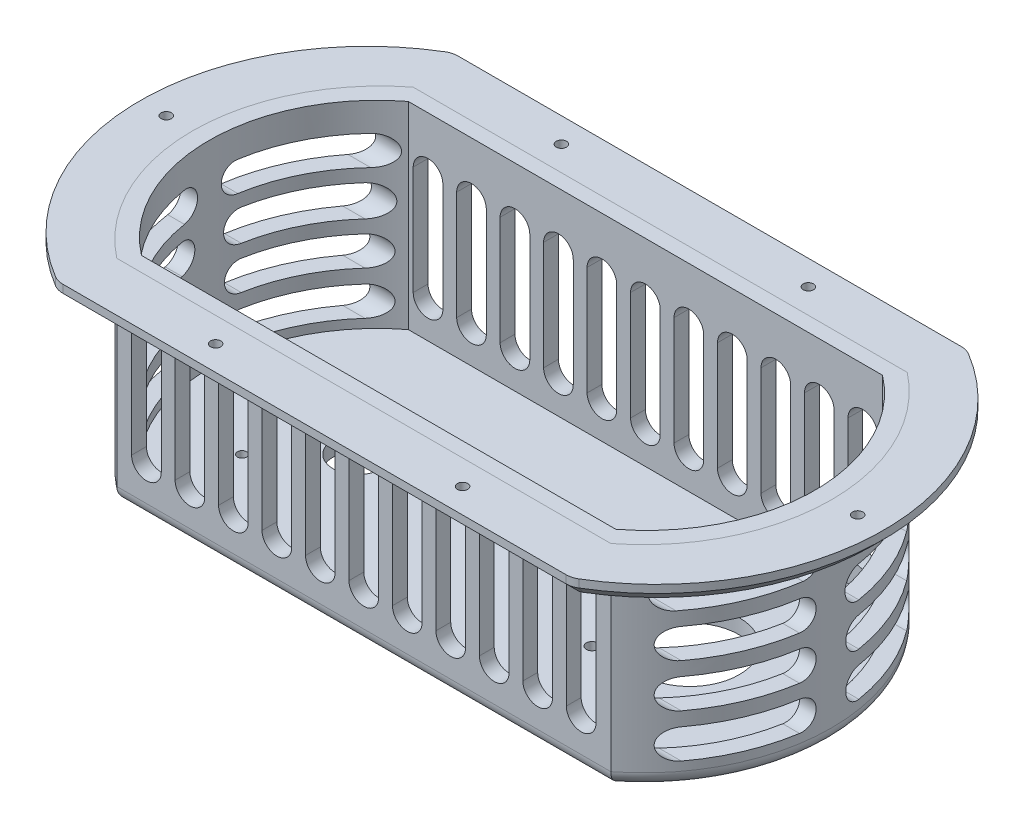
from build123d import *

# Parameters (mm, degrees)
BOSS_EXTRUDE1_DEPTH      = 10
BOSS_EXTRUDE2_DEPTH      = 100
CUT_EXTRUDE1_DEPTH       = 85
FILLET2_R                = 10
SKETCH10_R               = 4.6
CUT_EXTRUDE2_DEPTH       = 5
SKETCH10_3_R             = 4.6
CUT_EXTRUDE3_DEPTH       = 5
SKETCH10_4_R             = 4.6
CUT_EXTRUDE4_DEPTH       = 5
SKETCH10_5_R             = 4.6
CUT_EXTRUDE5_DEPTH       = 5
SKETCH10_6_R             = 4.6
CUT_EXTRUDE6_DEPTH       = 5
SKETCH10_7_R             = 4.6
CUT_EXTRUDE7_DEPTH       = 5
SKETCH12_R               = 2.6
CUT_EXTRUDE8_DEPTH       = 5
SKETCH12_3_R             = 2.6
CUT_EXTRUDE9_DEPTH       = 5
SKETCH12_4_R             = 2.6
CUT_EXTRUDE10_DEPTH      = 5
SKETCH12_5_R             = 2.6
CUT_EXTRUDE11_DEPTH      = 5
SKETCH12_6_R             = 2.6
CUT_EXTRUDE12_DEPTH      = 5
SKETCH12_7_R             = 2.6
CUT_EXTRUDE13_DEPTH      = 5
BOSS_EXTRUDE3_START      = 7.5
BOSS_EXTRUDE3_DEPTH      = 7.5
FILLET4_R                = 7.5
CUT_EXTRUDE17_DEPTH      = 15
CUT_EXTRUDE19_DEPTH      = 275.871968606
SKETCH46_R               = 2.35
CUT_EXTRUDE20_DEPTH      = 10
CUT_EXTRUDE21_DEPTH      = 165
CHAMFER1_SIZE            = 6
SKETCH49_R               = 25
SKETCH49_R_2             = 2.9
CUT_EXTRUDE22_DEPTH      = 239.703998976
CUT_EXTRUDE23_DEPTH      = 239.703998976
CUT_EXTRUDE23_DEPTH_BACK = 239.703998976
SKETCH50_R               = 12.5


with BuildPart() as part:
    # Sketch2 → Boss-Extrude1 (new body)
    with BuildSketch(Plane(origin=(0, 0, 0), x_dir=(1, 0, 0), z_dir=(0, 1, 0))):
        with BuildLine():
            Line((-130, 100), (130, 100))
            ThreePointArc((130, 100), (188.210916542, 0), (130, -100))
            Line((130, -100), (-130, -100))
            ThreePointArc((-130, -100), (-188.210916542, 0), (-130, 100))
        make_face()
        with BuildLine():
            Line((125, 75), (-125, 75))
            ThreePointArc((-125, 75), (-161.690481052, 0), (-125, -75))
            Line((-125, -75), (125, -75))
            ThreePointArc((125, -75), (161.690481052, 0), (125, 75))
        make_face(mode=Mode.SUBTRACT)
    extrude(amount=BOSS_EXTRUDE1_DEPTH)

    # Fillet2
    fillet2_edges = [part.edges().sort_by_distance(p)[0] for p in [
        (-130, 5, 100),
        (130, 5, 100),
        (-130, 5, -100),
        (130, 5, -100),
    ]]
    fillet(fillet2_edges, radius=FILLET2_R)

    # Sketch10 → Cut-Extrude2 (cut)
    with BuildSketch(Plane.XZ):
        with Locations((-174.950916542, 0)):
            Circle(SKETCH10_R)
    extrude(amount=-CUT_EXTRUDE2_DEPTH, mode=Mode.SUBTRACT)

    # Sketch10<3> → Cut-Extrude3 (cut)
    with BuildSketch(Plane.XZ):
        with Locations((-62.5, -87.5)):
            Circle(SKETCH10_3_R)
    extrude(amount=-CUT_EXTRUDE3_DEPTH, mode=Mode.SUBTRACT)

    # Sketch10<4> → Cut-Extrude4 (cut)
    with BuildSketch(Plane.XZ):
        with Locations((62.5, -87.5)):
            Circle(SKETCH10_4_R)
    extrude(amount=-CUT_EXTRUDE4_DEPTH, mode=Mode.SUBTRACT)

    # Sketch10<5> → Cut-Extrude5 (cut)
    with BuildSketch(Plane.XZ):
        with Locations((174.950481052, 0)):
            Circle(SKETCH10_5_R)
    extrude(amount=-CUT_EXTRUDE5_DEPTH, mode=Mode.SUBTRACT)

    # Sketch10<6> → Cut-Extrude6 (cut)
    with BuildSketch(Plane.XZ):
        with Locations((-62.5, 87.5)):
            Circle(SKETCH10_6_R)
    extrude(amount=-CUT_EXTRUDE6_DEPTH, mode=Mode.SUBTRACT)

    # Sketch10<7> → Cut-Extrude7 (cut)
    with BuildSketch(Plane.XZ):
        with Locations((62.5, 87.5)):
            Circle(SKETCH10_7_R)
    extrude(amount=-CUT_EXTRUDE7_DEPTH, mode=Mode.SUBTRACT)

    # Sketch12 → Cut-Extrude8 (cut)
    with BuildSketch(Plane.XZ.offset(-5)):
        with Locations((-174.950916542, 0)):
            Circle(SKETCH12_R)
    extrude(amount=-CUT_EXTRUDE8_DEPTH, mode=Mode.SUBTRACT)

    # Sketch12<3> → Cut-Extrude9 (cut)
    with BuildSketch(Plane.XZ.offset(-5)):
        with Locations((-62.5, 87.5)):
            Circle(SKETCH12_3_R)
    extrude(amount=-CUT_EXTRUDE9_DEPTH, mode=Mode.SUBTRACT)

    # Sketch12<4> → Cut-Extrude10 (cut)
    with BuildSketch(Plane.XZ.offset(-5)):
        with Locations((62.5, 87.5)):
            Circle(SKETCH12_4_R)
    extrude(amount=-CUT_EXTRUDE10_DEPTH, mode=Mode.SUBTRACT)

    # Sketch12<5> → Cut-Extrude11 (cut)
    with BuildSketch(Plane.XZ.offset(-5)):
        with Locations((174.950481052, 0)):
            Circle(SKETCH12_5_R)
    extrude(amount=-CUT_EXTRUDE11_DEPTH, mode=Mode.SUBTRACT)

    # Sketch12<6> → Cut-Extrude12 (cut)
    with BuildSketch(Plane.XZ.offset(-5)):
        with Locations((-62.5, -87.5)):
            Circle(SKETCH12_6_R)
    extrude(amount=-CUT_EXTRUDE12_DEPTH, mode=Mode.SUBTRACT)

    # Sketch12<7> → Cut-Extrude13 (cut)
    with BuildSketch(Plane.XZ.offset(-5)):
        with Locations((62.5, -87.5)):
            Circle(SKETCH12_7_R)
    extrude(amount=-CUT_EXTRUDE13_DEPTH, mode=Mode.SUBTRACT)

    # Chamfer1
    chamfer1_edges = [part.edges().sort_by_distance(p)[0] for p in [
        (188.210916542, 0, 0),
        (129.966798093, 0, -99.636241117),
        (129.966798093, 0, 99.636241117),
        (0, 0, -100),
        (0, 0, 100),
        (-129.966798093, 0, -99.636241117),
        (-129.966798093, 0, 99.636241117),
        (-188.210916542, 0, 0),
    ]]
    chamfer(chamfer1_edges, length=CHAMFER1_SIZE)


with BuildPart() as body_2:
    # Sketch3 → Boss-Extrude2 (new body)
    with BuildSketch(Plane(origin=(0, 10, 0), x_dir=(1, 0, 0), z_dir=(0, 1, 0))):
        with BuildLine():
            Line((125, 75), (-125, 75))
            ThreePointArc((-125, 75), (-161.690481052, 0), (-125, -75))
            Line((-125, -75), (125, -75))
            ThreePointArc((125, -75), (161.690481052, 0), (125, 75))
        make_face()
    extrude(amount=-BOSS_EXTRUDE2_DEPTH)

    # Sketch6 → Cut-Extrude1 (cut)
    with BuildSketch(Plane(origin=(0, 10, 0), x_dir=(-1, 0, 0), z_dir=(0, 1, 0))):
        with BuildLine():
            Line((120, 67.5), (-120, 67.5))
            ThreePointArc((-120, 67.5), (-153.340054201, 0), (-120, -67.5))
            Line((-120, -67.5), (120, -67.5))
            ThreePointArc((120, -67.5), (153.340054201, 0), (120, 67.5))
        make_face()
    extrude(amount=-CUT_EXTRUDE1_DEPTH, mode=Mode.SUBTRACT)

    # Sketch35 → Boss-Extrude3 (add)
    with BuildSketch(Plane.XZ.offset(90).offset(BOSS_EXTRUDE3_START)):
        with BuildLine():
            Line((125, 75), (-125, 75))
            ThreePointArc((-125, 75), (-161.690481052, 0), (-125, -75))
            Line((-125, -75), (125, -75))
            ThreePointArc((125, -75), (161.690481052, 0), (125, 75))
        make_face()
    extrude(amount=-BOSS_EXTRUDE3_DEPTH)

    # Fillet4
    fillet4_edges = [body_2.edges().sort_by_distance(p)[0] for p in [
        (0, -97.5, -75),
        (-161.690481052, -97.5, 0),
        (0, -97.5, 75),
        (161.690481052, -97.5, 0),
    ]]
    fillet(fillet4_edges, radius=FILLET4_R)

    # Sketch39 → Cut-Extrude17 (cut)
    with BuildSketch(Plane(origin=(0, -75, 0), x_dir=(1, 0, 0), z_dir=(0, 1, 0))):
        with BuildLine():
            Line((120, 67.5), (-120, 67.5))
            ThreePointArc((-120, 67.5), (-153.340054201, 0), (-120, -67.5))
            Line((-120, -67.5), (120, -67.5))
            ThreePointArc((120, -67.5), (153.340054201, 0), (120, 67.5))
        make_face()
    extrude(amount=-CUT_EXTRUDE17_DEPTH, mode=Mode.SUBTRACT)

    # Sketch40 → Cut-Extrude19 (cut, through all)
    with BuildSketch(Plane(origin=(0, 0, -75), x_dir=(-1, 0, 0), z_dir=(0, 0, -1))):
        with BuildLine():
            Line((7.5, -17.5), (7.5, -72.5))
            ThreePointArc((7.5, -72.5), (0, -80), (-7.5, -72.5))
            Line((-7.5, -72.5), (-7.5, -17.5))
            ThreePointArc((-7.5, -17.5), (0, -10), (7.5, -17.5))
        make_face()
        with BuildLine():
            Line((14.5, -17.5), (14.5, -72.5))
            ThreePointArc((14.5, -72.5), (22, -80), (29.5, -72.5))
            Line((29.5, -72.5), (29.5, -17.5))
            ThreePointArc((29.5, -17.5), (22, -10), (14.5, -17.5))
        make_face()
        with BuildLine():
            Line((36.5, -17.5), (36.5, -72.5))
            ThreePointArc((36.5, -72.5), (44, -80), (51.5, -72.5))
            Line((51.5, -72.5), (51.5, -17.5))
            ThreePointArc((51.5, -17.5), (44, -10), (36.5, -17.5))
        make_face()
        with BuildLine():
            Line((58.5, -17.5), (58.5, -72.5))
            ThreePointArc((58.5, -72.5), (66, -80), (73.5, -72.5))
            Line((73.5, -72.5), (73.5, -17.5))
            ThreePointArc((73.5, -17.5), (66, -10), (58.5, -17.5))
        make_face()
        with BuildLine():
            Line((80.5, -17.5), (80.5, -72.5))
            ThreePointArc((80.5, -72.5), (88, -80), (95.5, -72.5))
            Line((95.5, -72.5), (95.5, -17.5))
            ThreePointArc((95.5, -17.5), (88, -10), (80.5, -17.5))
        make_face()
        with BuildLine():
            Line((102.5, -17.5), (102.5, -72.5))
            ThreePointArc((102.5, -72.5), (110, -80), (117.5, -72.5))
            Line((117.5, -72.5), (117.5, -17.5))
            ThreePointArc((117.5, -17.5), (110, -10), (102.5, -17.5))
        make_face()
        with BuildLine():
            Line((-29.5, -17.5), (-29.5, -72.5))
            ThreePointArc((-29.5, -72.5), (-22, -80), (-14.5, -72.5))
            Line((-14.5, -72.5), (-14.5, -17.5))
            ThreePointArc((-14.5, -17.5), (-22, -10), (-29.5, -17.5))
        make_face()
        with BuildLine():
            Line((-51.5, -17.5), (-51.5, -72.5))
            ThreePointArc((-51.5, -72.5), (-44, -80), (-36.5, -72.5))
            Line((-36.5, -72.5), (-36.5, -17.5))
            ThreePointArc((-36.5, -17.5), (-44, -10), (-51.5, -17.5))
        make_face()
        with BuildLine():
            Line((-73.5, -17.5), (-73.5, -72.5))
            ThreePointArc((-73.5, -72.5), (-66, -80), (-58.5, -72.5))
            Line((-58.5, -72.5), (-58.5, -17.5))
            ThreePointArc((-58.5, -17.5), (-66, -10), (-73.5, -17.5))
        make_face()
        with BuildLine():
            Line((-95.5, -17.5), (-95.5, -72.5))
            ThreePointArc((-95.5, -72.5), (-88, -80), (-80.5, -72.5))
            Line((-80.5, -72.5), (-80.5, -17.5))
            ThreePointArc((-80.5, -17.5), (-88, -10), (-95.5, -17.5))
        make_face()
        with BuildLine():
            Line((-117.5, -17.5), (-117.5, -72.5))
            ThreePointArc((-117.5, -72.5), (-110, -80), (-102.5, -72.5))
            Line((-102.5, -72.5), (-102.5, -17.5))
            ThreePointArc((-102.5, -17.5), (-110, -10), (-117.5, -17.5))
        make_face()
    extrude(amount=-CUT_EXTRUDE19_DEPTH, mode=Mode.SUBTRACT)

    # Sketch46 → Cut-Extrude20 (cut)
    with BuildSketch(Plane.XZ.offset(97.5)):
        with Locations((-107.36812468, 29.26)):
            Circle(SKETCH46_R)
        with Locations((-48.84812468, 29.26)):
            Circle(SKETCH46_R)
        with Locations((-48.84812468, -29.26)):
            Circle(SKETCH46_R)
        with Locations((-107.36812468, -29.26)):
            Circle(SKETCH46_R)
    extrude(amount=-CUT_EXTRUDE20_DEPTH, mode=Mode.SUBTRACT)

    # Sketch48 → Cut-Extrude21 (cut, symmetric)
    with BuildSketch(Plane(origin=(0, 0, 0), x_dir=(0, 0, -1), z_dir=(1, 0, 0))):
        with BuildLine():
            Line((-58.5, -4.5), (-13.5, -4.5))
            ThreePointArc((-13.5, -4.5), (-6, -12), (-13.5, -19.5))
            Line((-13.5, -19.5), (-58.5, -19.5))
            ThreePointArc((-58.5, -19.5), (-66, -12), (-58.5, -4.5))
        make_face()
        with BuildLine():
            Line((13.5, -4.5), (58.5, -4.5))
            ThreePointArc((58.5, -4.5), (66, -12), (58.5, -19.5))
            Line((58.5, -19.5), (13.5, -19.5))
            ThreePointArc((13.5, -19.5), (6, -12), (13.5, -4.5))
        make_face()
        with BuildLine():
            Line((-57, -26.5), (-15, -26.5))
            ThreePointArc((-15, -26.5), (-7.5, -34), (-15, -41.5))
            Line((-15, -41.5), (-57, -41.5))
            ThreePointArc((-57, -41.5), (-64.5, -34), (-57, -26.5))
        make_face()
        with BuildLine():
            Line((15, -26.073404774), (57, -26.073404774))
            ThreePointArc((57, -26.073404774), (64.926595226, -34), (57, -41.926595226))
            Line((57, -41.926595226), (15, -41.926595226))
            ThreePointArc((15, -41.926595226), (7.073404774, -34), (15, -26.073404774))
        make_face()
        with BuildLine():
            Line((-57, -48.5), (-15, -48.5))
            ThreePointArc((-15, -48.5), (-7.5, -56), (-15, -63.5))
            Line((-15, -63.5), (-57, -63.5))
            ThreePointArc((-57, -63.5), (-64.5, -56), (-57, -48.5))
        make_face()
        with BuildLine():
            Line((15, -48.5), (57, -48.5))
            ThreePointArc((57, -48.5), (64.5, -56), (57, -63.5))
            Line((57, -63.5), (15, -63.5))
            ThreePointArc((15, -63.5), (7.5, -56), (15, -48.5))
        make_face()
        with BuildLine():
            Line((-57, -70.5), (-15, -70.5))
            ThreePointArc((-15, -70.5), (-7.5, -78), (-15, -85.5))
            Line((-15, -85.5), (-57, -85.5))
            ThreePointArc((-57, -85.5), (-64.5, -78), (-57, -70.5))
        make_face()
        with BuildLine():
            Line((15, -70.5), (57, -70.5))
            ThreePointArc((57, -70.5), (64.5, -78), (57, -85.5))
            Line((57, -85.5), (15, -85.5))
            ThreePointArc((15, -85.5), (7.5, -78), (15, -70.5))
        make_face()
    extrude(amount=CUT_EXTRUDE21_DEPTH, both=True, mode=Mode.SUBTRACT)

    # Sketch49 → Cut-Extrude22 (cut, through all)
    with BuildSketch(Plane(origin=(0, -97.5, 0), x_dir=(-1, 0, 0), z_dir=(0, -1, 0))):
        with Locations((-90, 0)):
            Circle(SKETCH49_R)
        with Locations((-65.251262658, -24.748737342)):
            Circle(SKETCH49_R_2)
        with Locations((-114.748737342, -24.748737342)):
            Circle(SKETCH49_R_2)
        with Locations((-114.748737342, 24.748737342)):
            Circle(SKETCH49_R_2)
        with Locations((-65.251262658, 24.748737342)):
            Circle(SKETCH49_R_2)
    extrude(amount=-CUT_EXTRUDE22_DEPTH, mode=Mode.SUBTRACT)

    # Sketch50 → Cut-Extrude23 (cut, two sides: drawn at the far end of the back side and taken through both)
    with BuildSketch(Plane.XZ.offset(97.5).offset(-CUT_EXTRUDE23_DEPTH_BACK)):
        with Locations((-78.10812468, 0)):
            Circle(SKETCH50_R)
    extrude(amount=CUT_EXTRUDE23_DEPTH + CUT_EXTRUDE23_DEPTH_BACK, mode=Mode.SUBTRACT)


solid = Compound([part.part, body_2.part])
